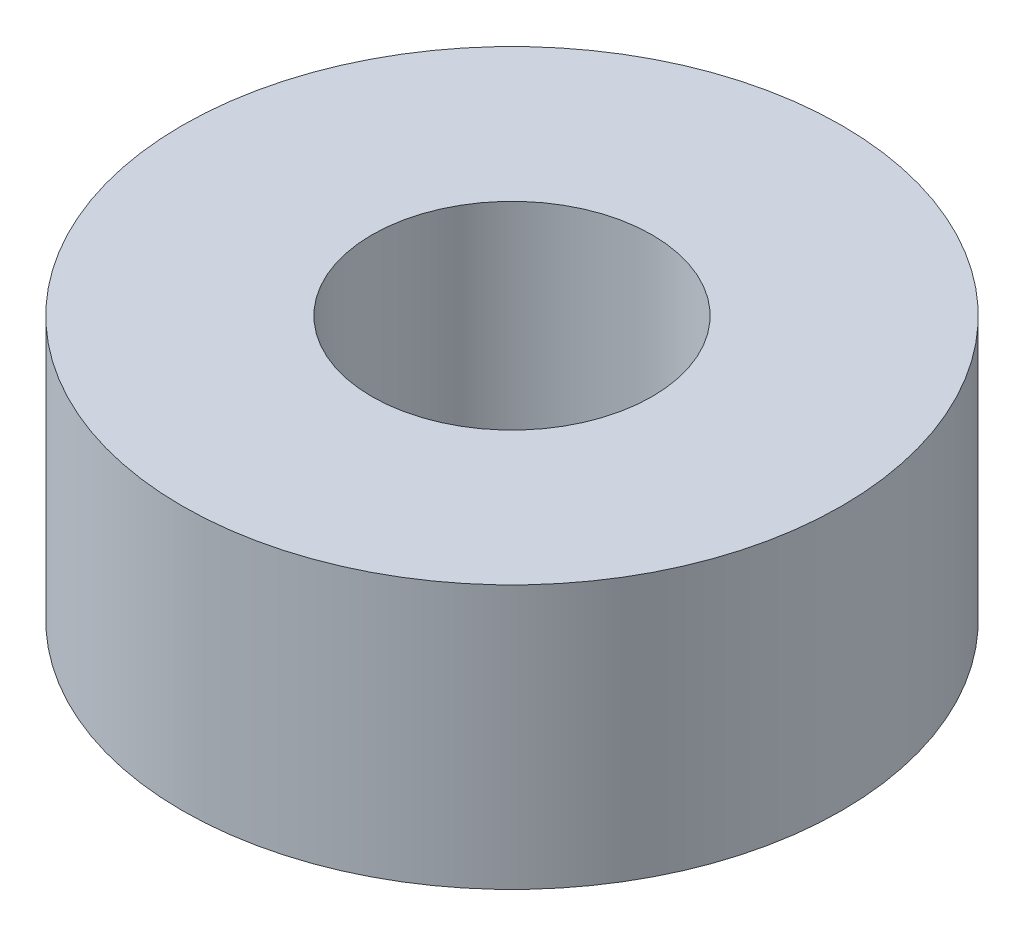
from build123d import *

# Parameters (mm, degrees)
BUJE_D20_START  = -4
CROQUIS1_R      = 10
BUJE_D20_DEPTH  = 8
ROSCA_M10_START = -4
CROQUIS2_R      = 4.25
ROSCA_M10_DEPTH = 8


with BuildPart() as part:
    # Croquis1 → Buje_D20 (new body)
    with BuildSketch(Plane(origin=(0, 0, 0), x_dir=(1, 0, 0), z_dir=(0, 1, 0)).offset(BUJE_D20_START)):
        with Locations(Location((0, -171.45, 0), (0, 0, 270))):
            Circle(CROQUIS1_R)
    extrude(amount=BUJE_D20_DEPTH)

    # Croquis2 → Rosca_M10 (cut)
    with BuildSketch(Plane(origin=(0, 0, 0), x_dir=(1, 0, 0), z_dir=(0, 1, 0)).offset(ROSCA_M10_START)):
        with Locations(Location((0, -171.45, 0), (0, 0, 270))):
            Circle(CROQUIS2_R)
    extrude(amount=ROSCA_M10_DEPTH, mode=Mode.SUBTRACT)


solid = part.part
